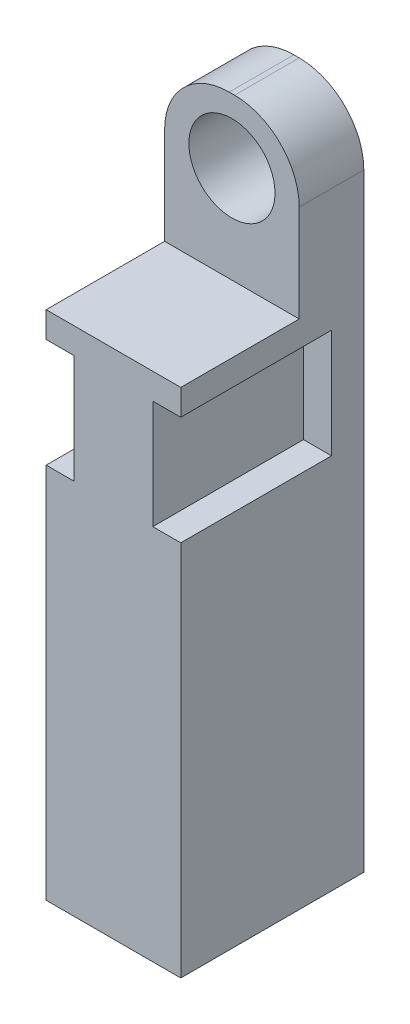
from build123d import *

# Parameters (mm, degrees)
SKETCH1_W           = 25
SKETCH1_H           = 34
SKETCH1_W_2         = 20.5
SKETCH1_H_2         = 20.5
BOSS_EXTRUDE1_DEPTH = 40
SKETCH2_W           = 25
SKETCH2_H           = 34
BOSS_EXTRUDE2_DEPTH = 55
SKETCH3_W           = 25
SKETCH3_H           = 12
BOSS_EXTRUDE3_DEPTH = 20
SKETCH4_W           = 25
SKETCH4_H           = 12
BOSS_EXTRUDE4_DEPTH = 10
SKETCH6_R           = 8
CUT_EXTRUDE1_DEPTH  = 12
FILLET1_R           = 12
SKETCH7_W           = 5.2
SKETCH7_H           = 20.2
CUT_EXTRUDE2_DEPTH  = 28


with BuildPart() as part:
    # Sketch1 → Boss-Extrude1 (new body)
    with BuildSketch(Plane(origin=(0, 0, 0), x_dir=(1, 0, 0), z_dir=(0, 1, 0))):
        with Locations((0, 4.5)):
            Rectangle(SKETCH1_W, SKETCH1_H)
        Rectangle(SKETCH1_W_2, SKETCH1_H_2, mode=Mode.SUBTRACT)
    extrude(amount=BOSS_EXTRUDE1_DEPTH)

    # Sketch2 → Boss-Extrude2 (add)
    with BuildSketch(Plane(origin=(0, 40, 0), x_dir=(1, 0, 0), z_dir=(0, 1, 0))):
        with Locations((0, 4.5)):
            Rectangle(SKETCH2_W, SKETCH2_H)
    extrude(amount=BOSS_EXTRUDE2_DEPTH)

    # Sketch3 → Boss-Extrude3 (add)
    with BuildSketch(Plane(origin=(0, 95, 0), x_dir=(1, 0, 0), z_dir=(0, 1, 0))):
        with Locations((0, 15.5)):
            Rectangle(SKETCH3_W, SKETCH3_H)
    extrude(amount=BOSS_EXTRUDE3_DEPTH)

    # Sketch4 → Boss-Extrude4 (add)
    with BuildSketch(Plane(origin=(0, 115, 0), x_dir=(1, 0, 0), z_dir=(0, 1, 0))):
        with Locations((0, 15.5)):
            Rectangle(SKETCH4_W, SKETCH4_H)
    extrude(amount=BOSS_EXTRUDE4_DEPTH)

    # Sketch6 → Cut-Extrude1 (cut)
    with BuildSketch(Plane.XY.offset(-9.5)):
        with Locations((0, 113)):
            Circle(SKETCH6_R)
    extrude(amount=-CUT_EXTRUDE1_DEPTH, mode=Mode.SUBTRACT)

    # Fillet1
    fillet1_edges = [part.edges().sort_by_distance(p)[0] for p in [
        (-12.5, 125, -15.5),
        (12.5, 125, -15.5),
    ]]
    fillet(fillet1_edges, radius=FILLET1_R)

    # Sketch7 → Cut-Extrude2 (cut)
    with BuildSketch(Plane.XY.offset(12.5)):
        with Locations((-9.9, 80.1)):
            Rectangle(SKETCH7_W, SKETCH7_H)
        with Locations((9.9, 80.1)):
            Rectangle(SKETCH7_W, SKETCH7_H)
    extrude(amount=-CUT_EXTRUDE2_DEPTH, mode=Mode.SUBTRACT)


solid = part.part
